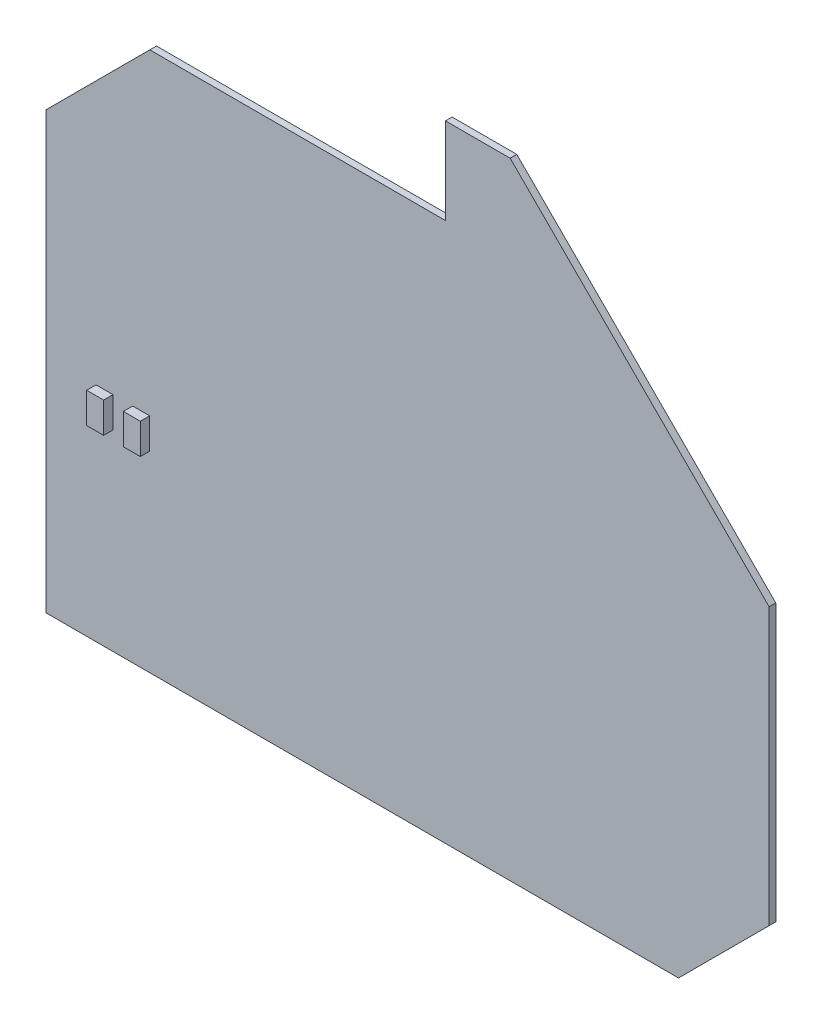
from build123d import *

# Parameters (mm, degrees)
BOARD_DEPTH                   = 0.3912
RESC1608X55X30ML20T10_1_DEPTH = 0.55
RESC1608X55X30ML20T10_2_DEPTH = 0.55


with BuildPart() as part:
    # Эскиз1 → BOARD (new body)
    with BuildSketch(Plane.XY):
        Polygon((55.245, 7.62), (55.245, 33.274), (61.341, 39.37), (78.74, 39.37), (78.74, 44.45), (82.55, 44.45), (97.79, 29.21), (97.79, 12.954), (92.456, 7.62), align=None)
    extrude(amount=BOARD_DEPTH)


with BuildPart() as body_2:
    # Эскиз2 → RESC1608X55X30ML20T10-1 (new body)
    with BuildSketch(Plane.XY.offset(0.3912)):
        Polygon((61.333, 20.412), (61.333, 19.212), (61.333, 18.912), (60.333, 18.912), (60.333, 19.212), (60.333, 20.412), (60.333, 20.712), (61.333, 20.712), align=None)
    extrude(amount=RESC1608X55X30ML20T10_1_DEPTH)


with BuildPart() as body_3:
    # Эскиз3 → RESC1608X55X30ML20T10-2 (new body)
    with BuildSketch(Plane.XY.offset(0.3912)):
        Polygon((59.174, 20.412), (59.174, 19.212), (59.174, 18.912), (58.174, 18.912), (58.174, 19.212), (58.174, 20.412), (58.174, 20.712), (59.174, 20.712), align=None)
    extrude(amount=RESC1608X55X30ML20T10_2_DEPTH)


solid = Compound([part.part, body_2.part, body_3.part])
